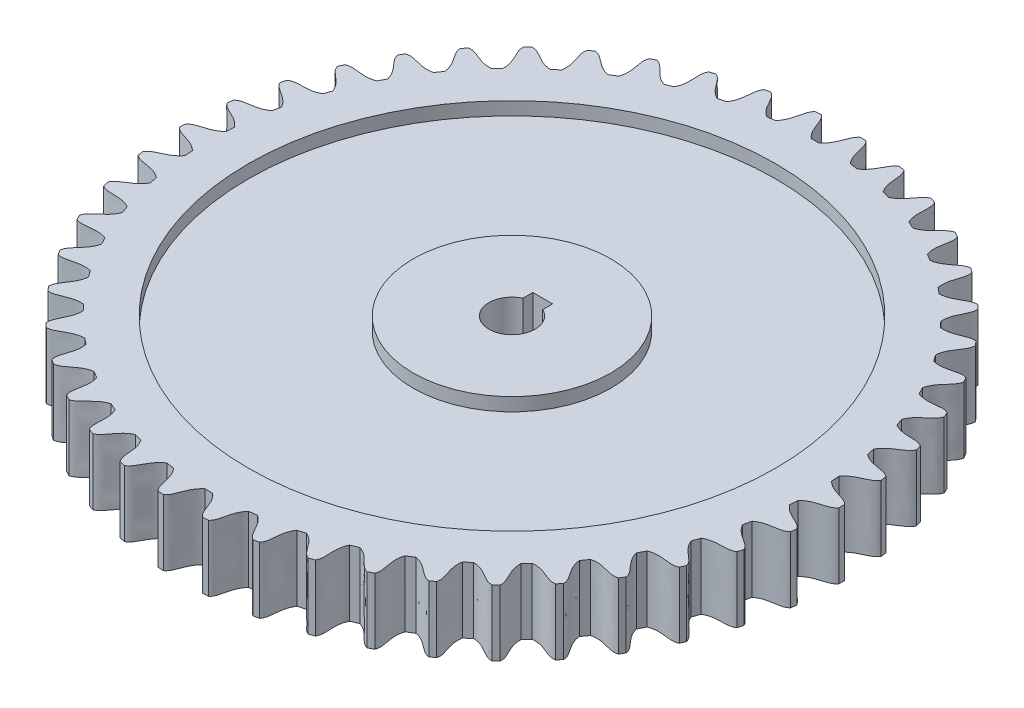
from build123d import *

# Parameters (mm, degrees)
ESQUISSE1_R                  = 50
BOSS_EXTRU_2_DEPTH           = 10
ENL_V_MAT_EXTRU_2_DEPTH      = 100
R_P_TITION_CIRCULAIRE3_COUNT = 46
ESQUISSE4_R                  = 40
ESQUISSE4_R_2                = 15
ENL_V_MAT_EXTRU_3_DEPTH      = 2
ENL_V_START                  = -2
ESQUISSE5_R                  = 40
ESQUISSE5_R_2                = 15
ENL_V_MAT_EXTRU_4_DEPTH      = 2


with BuildPart() as part:
    # Esquisse1 → Boss.-Extru.2 (new body)
    with BuildSketch(Plane(origin=(0, 0, 0), x_dir=(1, 0, 0), z_dir=(0, 1, 0))):
        with Locations(Location((0, 0, 0), (0, 0, 270))):
            Circle(ESQUISSE1_R)
        with BuildLine():
            Line((-1.5, 3.16227766), (-1.5, 4.66227766))
            Line((-1.5, 4.66227766), (1.5, 4.66227766))
            Line((1.5, 4.66227766), (1.5, 3.16227766))
            ThreePointArc((1.5, 3.16227766), (0, -3.5), (-1.5, 3.16227766))
        make_face(mode=Mode.SUBTRACT)
    extrude(amount=BOSS_EXTRU_2_DEPTH)

    # Esquisse3 → Enlèv. mat.-Extru.2 (cut)
    with BuildSketch(Plane(origin=(0, 10, 0), x_dir=(1, 0, 0), z_dir=(0, 1, 0))):
        with BuildLine():
            Line((-0.6, 46), (0.6, 46))
            add(Edge.make_bspline(
                [(0.6, 46), (2.116632645, 47.311931796), (1.895430447, 49.124844836), (2.984293985, 49.910860435)],
                knots=[0, 0, 0, 0, 1, 1, 1, 1], degree=3))
            ThreePointArc((2.984293985, 49.910860435), (0, 52.985624968), (-2.984293985, 49.910860435))
            add(Edge.make_bspline(
                [(-0.6, 46), (-2.116632645, 47.311931796), (-1.895430447, 49.124844836), (-2.984293985, 49.910860435)],
                knots=[0, 0, 0, 0, 1, 1, 1, 1], degree=3))
        make_face()
    enl_v_mat_extru_2 = extrude(amount=-ENL_V_MAT_EXTRU_2_DEPTH, mode=Mode.SUBTRACT)

    # Répétition circulaire3: Enlèv. mat.-Extru.2 ×46 about axis
    r_p_tition_circulaire3_axis = Axis((0, 10, 0), (0, 1, 0))
    for i in range(1, R_P_TITION_CIRCULAIRE3_COUNT):
        add(enl_v_mat_extru_2.rotate(r_p_tition_circulaire3_axis, i * 360 / R_P_TITION_CIRCULAIRE3_COUNT), mode=Mode.SUBTRACT)

    # Esquisse4 → Enlèv. mat.-Extru.3 (cut)
    with BuildSketch(Plane(origin=(0, 10, 0), x_dir=(1, 0, 0), z_dir=(0, 1, 0))):
        with Locations(Location((0, 0, 0), (0, 0, 270))):
            Circle(ESQUISSE4_R)
        with Locations(Location((0, 0, 0), (0, 0, 270))):
            Circle(ESQUISSE4_R_2, mode=Mode.SUBTRACT)
    extrude(amount=-ENL_V_MAT_EXTRU_3_DEPTH, mode=Mode.SUBTRACT)

    # Esquisse5 → Enlèv. mat.-Extru.4 (cut)
    with BuildSketch(Plane.XZ.offset(ENL_V_START)):
        with Locations(Location((0, 0, 0), (0, 0, 90))):
            Circle(ESQUISSE5_R)
        with Locations(Location((0, 0, 0), (0, 0, 90))):
            Circle(ESQUISSE5_R_2, mode=Mode.SUBTRACT)
    extrude(amount=ENL_V_MAT_EXTRU_4_DEPTH, mode=Mode.SUBTRACT)


solid = part.part
